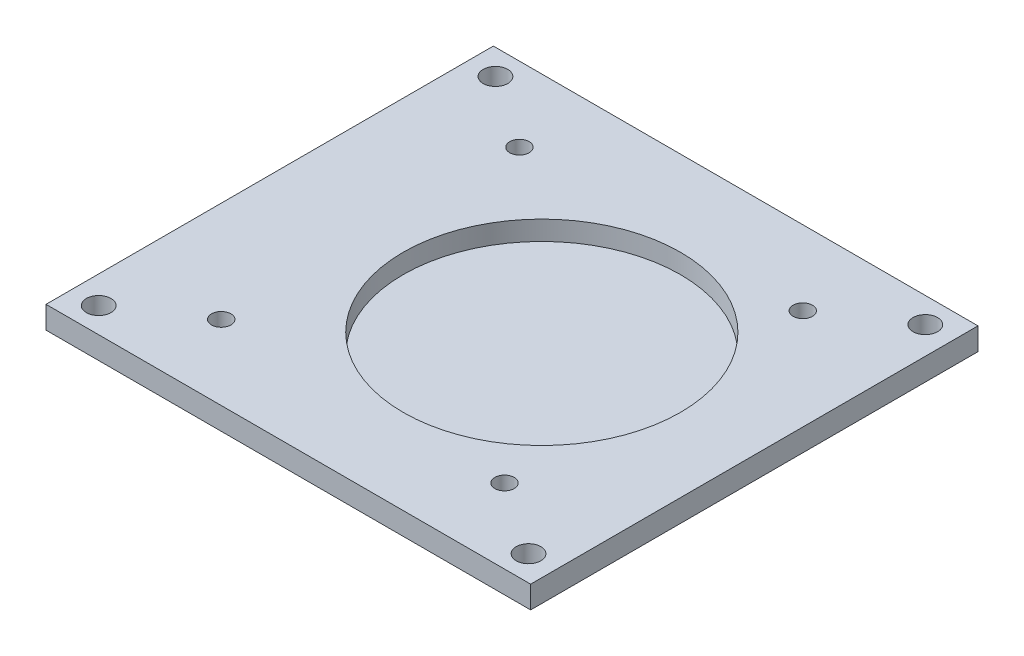
from build123d import *

# Parameters (mm, degrees)
SKETCH3_W           = 65
SKETCH3_H           = 60
BOSS_EXTRUDE3_DEPTH = 3
CUT_EXTRUDE1_REACH  = 57.839
SKETCH4_R           = 1.3
SKETCH9_R           = 3.2
SKETCH9_R_2         = 1.6
BOSS_EXTRUDE5_DEPTH = 5.6
SKETCH10_R          = 18.6
CUT_EXTRUDE3_DEPTH  = 2.6
SKETCH11_R          = 1.65
CUT_EXTRUDE4_DEPTH  = 57.41772771
FILLET1_R           = 1


with BuildPart() as part:
    # Sketch3 → Boss-Extrude3 (new body)
    with BuildSketch(Plane(origin=(0, 0, 0), x_dir=(1, 0, 0), z_dir=(0, 1, 0))):
        with Locations((-14.5, 0)):
            Rectangle(SKETCH3_W, SKETCH3_H)
    extrude(amount=BOSS_EXTRUDE3_DEPTH)

    # Sketch4 → Cut-Extrude1 (cut, up to next)
    with BuildSketch(Plane(origin=(0, 3, 0), x_dir=(1, 0, 0), z_dir=(0, 1, 0)), mode=Mode.PRIVATE) as cut_extrude1_sk1:
        with Locations(Location((-33.5, 20, 0), (0, 0, 270))):
            Circle(SKETCH4_R)
    cut_extrude1_tool1 = extrude(cut_extrude1_sk1.sketch, amount=-CUT_EXTRUDE1_REACH, mode=Mode.PRIVATE) & part.part
    # Sketch4 → Cut-Extrude1 (cut, up to next)
    with BuildSketch(Plane(origin=(0, 3, 0), x_dir=(1, 0, 0), z_dir=(0, 1, 0)), mode=Mode.PRIVATE) as cut_extrude1_sk2:
        with Locations(Location((4.5, 20, 0), (0, 0, 270))):
            Circle(SKETCH4_R)
    cut_extrude1_tool2 = extrude(cut_extrude1_sk2.sketch, amount=-CUT_EXTRUDE1_REACH, mode=Mode.PRIVATE) & part.part
    # Sketch4 → Cut-Extrude1 (cut, up to next)
    with BuildSketch(Plane(origin=(0, 3, 0), x_dir=(1, 0, 0), z_dir=(0, 1, 0)), mode=Mode.PRIVATE) as cut_extrude1_sk3:
        with Locations(Location((4.5, -20, 0), (0, 0, 270))):
            Circle(SKETCH4_R)
    cut_extrude1_tool3 = extrude(cut_extrude1_sk3.sketch, amount=-CUT_EXTRUDE1_REACH, mode=Mode.PRIVATE) & part.part
    # Sketch4 → Cut-Extrude1 (cut, up to next)
    with BuildSketch(Plane(origin=(0, 3, 0), x_dir=(1, 0, 0), z_dir=(0, 1, 0)), mode=Mode.PRIVATE) as cut_extrude1_sk4:
        with Locations(Location((-33.5, -20, 0), (0, 0, 270))):
            Circle(SKETCH4_R)
    cut_extrude1_tool4 = extrude(cut_extrude1_sk4.sketch, amount=-CUT_EXTRUDE1_REACH, mode=Mode.PRIVATE) & part.part
    add(cut_extrude1_tool1.solids().sort_by_distance((-33.5, 3, -20))[0], mode=Mode.SUBTRACT)
    add(cut_extrude1_tool2.solids().sort_by_distance((4.5, 3, -20))[0], mode=Mode.SUBTRACT)
    add(cut_extrude1_tool3.solids().sort_by_distance((4.5, 3, 20))[0], mode=Mode.SUBTRACT)
    add(cut_extrude1_tool4.solids().sort_by_distance((-33.5, 3, 20))[0], mode=Mode.SUBTRACT)

    # Sketch9 → Boss-Extrude5 (add)
    # profile 1 of 4: a face of its own
    with BuildSketch(Plane.XZ):
        with Locations(Location((-33.5, 20, 0), (0, 0, 270))):
            Circle(SKETCH9_R)
        with Locations(Location((-33.5, 20, 0), (0, 0, 270))):
            Circle(SKETCH9_R_2, mode=Mode.SUBTRACT)
    # profile 2 of 4: a face of its own
    with BuildSketch(Plane.XZ):
        with Locations(Location((-33.5, -20, 0), (0, 0, 270))):
            Circle(SKETCH9_R)
        with Locations(Location((-33.5, -20, 0), (0, 0, 270))):
            Circle(SKETCH9_R_2, mode=Mode.SUBTRACT)
    # profile 3 of 4: a face of its own
    with BuildSketch(Plane.XZ):
        with Locations(Location((4.5, 20, 0), (0, 0, 270))):
            Circle(SKETCH9_R)
        with Locations(Location((4.5, 20, 0), (0, 0, 270))):
            Circle(SKETCH9_R_2, mode=Mode.SUBTRACT)
    # profile 4 of 4: a face of its own
    with BuildSketch(Plane.XZ):
        with Locations(Location((4.5, -20, 0), (0, 0, 270))):
            Circle(SKETCH9_R)
        with Locations(Location((4.5, -20, 0), (0, 0, 270))):
            Circle(SKETCH9_R_2, mode=Mode.SUBTRACT)
    extrude(amount=BOSS_EXTRUDE5_DEPTH)

    # Sketch10 → Cut-Extrude3 (cut)
    with BuildSketch(Plane(origin=(0, 3, 0), x_dir=(1, 0, 0), z_dir=(0, 1, 0))):
        with Locations(Location((-10.5, 0, 0), (0, 0, 270))):
            Circle(SKETCH10_R)
    extrude(amount=-CUT_EXTRUDE3_DEPTH, mode=Mode.SUBTRACT)

    # Sketch11 → Cut-Extrude4 (cut, through all)
    with BuildSketch(Plane(origin=(0, 3, 0), x_dir=(1, 0, 0), z_dir=(0, 1, 0))):
        with Locations(Location((14.325982777, -26.608599486, 0), (0, 0, 270))):
            Circle(SKETCH11_R)
        with Locations(Location((-43.325982777, -26.608599486, 0), (0, 0, 270))):
            Circle(SKETCH11_R)
        with Locations(Location((14.325982777, 26.608599486, 0), (0, 0, 270))):
            Circle(SKETCH11_R)
        with Locations(Location((-43.325982777, 26.608599486, 0), (0, 0, 270))):
            Circle(SKETCH11_R)
    extrude(amount=-CUT_EXTRUDE4_DEPTH, mode=Mode.SUBTRACT)

    # Fillet1
    fillet1_edges = [part.edges().sort_by_distance(p)[0] for p in [
        (-33.5, -5.6, 21.6),
        (-33.5, -5.6, -18.4),
        (4.5, -5.6, 21.6),
        (4.5, -5.6, -18.4),
    ]]
    fillet(fillet1_edges, radius=FILLET1_R)


solid = part.part
